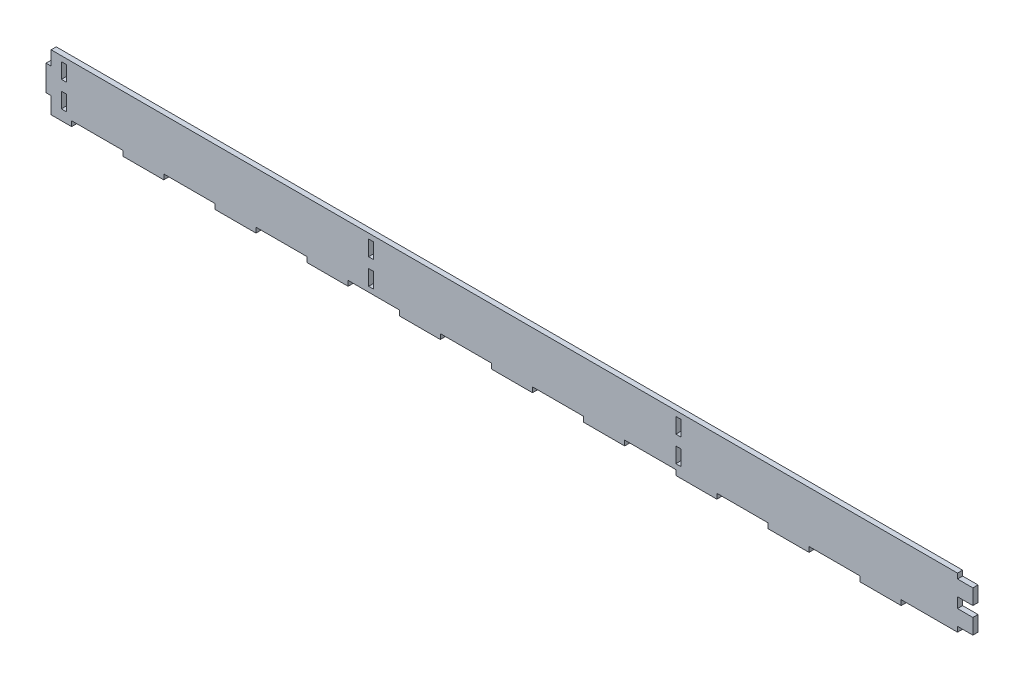
from build123d import *

# Parameters (mm, degrees)
SKETCH1_W           = 5
SKETCH1_H           = 15
BOSS_EXTRUDE1_DEPTH = 5


with BuildPart() as part:
    # Sketch1 → Boss-Extrude1 (new body)
    with BuildSketch(Plane.XY):
        Polygon((885, 50), (0, 50), (0, 36.209811371), (-5, 36.209811371), (-5, 11.209811371), (0, 11.209811371), (0, -5), (20, -5), (20, 0), (70, 0), (70, -5), (110, -5), (110, 0), (160, 0), (160, -5), (200, -5), (200, 0), (250, 0), (250, -5), (290, -5), (290, 0), (340, 0), (340, -5), (380, -5), (380, 0), (430, 0), (430, -5), (470, -5), (470, 0), (520, 0), (520, -5), (560, -5), (560, 0), (610, 0), (610, -5), (650, -5), (650, 0), (700, 0), (700, -5), (740, -5), (740, 0), (790, 0), (790, -5), (830, -5), (830, 0), (885, 0), (885, 5), (900, 5), (900, 20), (885, 20), (885, 30), (900, 30), (900, 45), (885, 45), align=None)
        with Locations((12.5, 12.5)):
            Rectangle(SKETCH1_W, SKETCH1_H, mode=Mode.SUBTRACT)
        with Locations((312.5, 12.5)):
            Rectangle(SKETCH1_W, SKETCH1_H, mode=Mode.SUBTRACT)
        with Locations((612.5, 12.5)):
            Rectangle(SKETCH1_W, SKETCH1_H, mode=Mode.SUBTRACT)
        with Locations((12.5, 37.5)):
            Rectangle(SKETCH1_W, SKETCH1_H, mode=Mode.SUBTRACT)
        with Locations((312.5, 37.5)):
            Rectangle(SKETCH1_W, SKETCH1_H, mode=Mode.SUBTRACT)
        with Locations((612.5, 37.5)):
            Rectangle(SKETCH1_W, SKETCH1_H, mode=Mode.SUBTRACT)
    extrude(amount=-BOSS_EXTRUDE1_DEPTH)


solid = part.part
